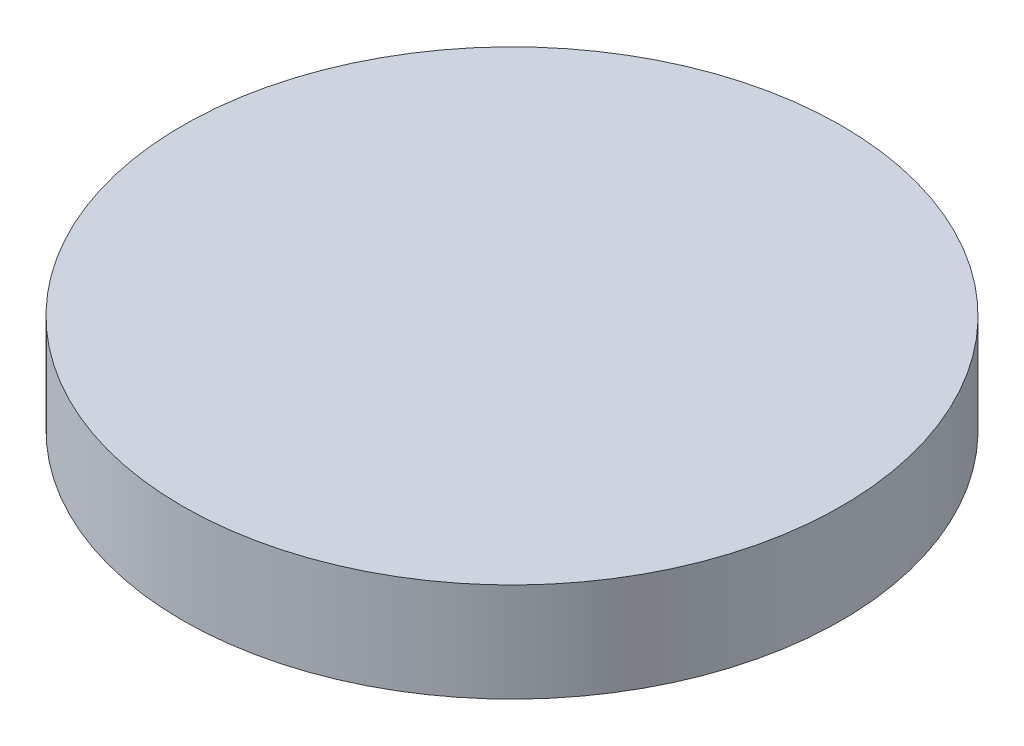
from build123d import *

# Parameters (mm, degrees)
SKETCH1_R           = 50
BOSS_EXTRUDE1_DEPTH = 15


with BuildPart() as part:
    # Sketch1 → Boss-Extrude1 (new body)
    with BuildSketch(Plane(origin=(0, 0, 0), x_dir=(1, 0, 0), z_dir=(0, 1, 0))):
        with Locations(Location((0, 0, 0), (0, 0, 270))):
            Circle(SKETCH1_R)
    extrude(amount=BOSS_EXTRUDE1_DEPTH)


solid = part.part
